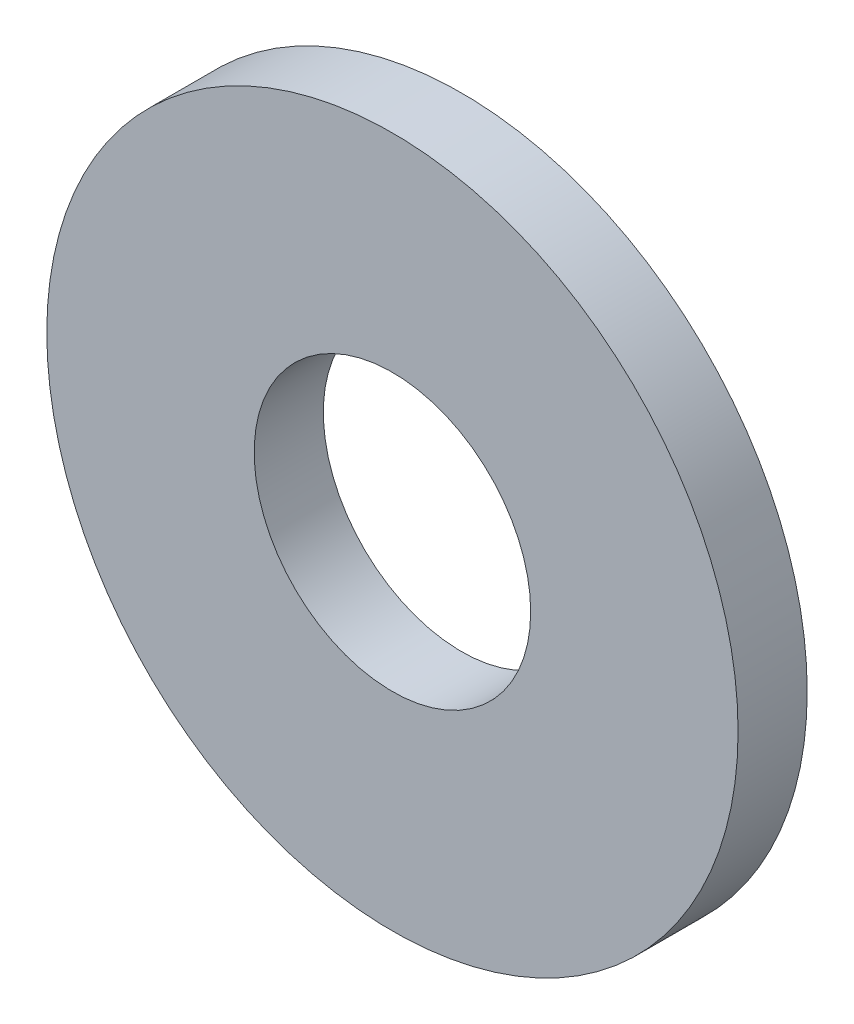
from build123d import *

# Parameters (mm, degrees)
SKETCH_1_R      = 4
SKETCH_1_R_2    = 1.6
EXTRUDE_1_DEPTH = 0.8


with BuildPart() as part:
    # 草图1 → 凸台-拉伸1 (new body)
    with BuildSketch(Plane.XY):
        Circle(SKETCH_1_R)
        Circle(SKETCH_1_R_2, mode=Mode.SUBTRACT)
    extrude(amount=EXTRUDE_1_DEPTH)


solid = part.part
